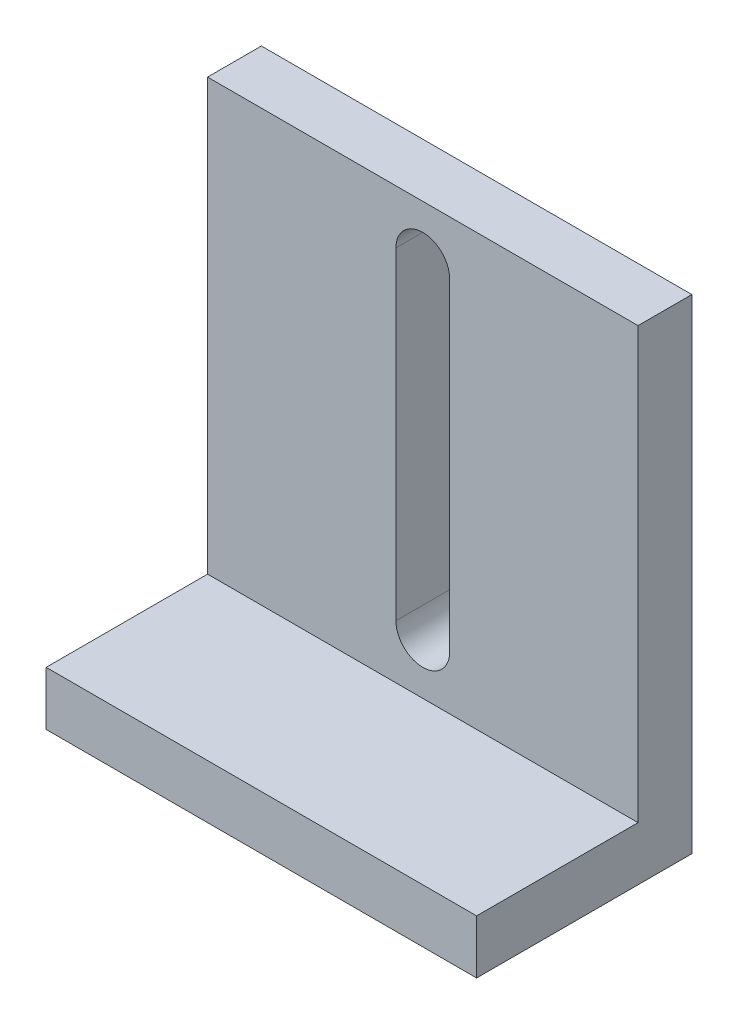
from build123d import *

# Parameters (mm, degrees)
SKETCH1_W           = 25.4
SKETCH1_H           = 12.7
BOSS_EXTRUDE1_DEPTH = 3.175
SKETCH2_W           = 25.4
SKETCH2_H           = 3.175
BOSS_EXTRUDE2_DEPTH = 25.4
CUT_EXTRUDE1_DEPTH  = 33.688625698


with BuildPart() as part:
    # Sketch1 → Boss-Extrude1 (new body)
    with BuildSketch(Plane(origin=(0, 0, 0), x_dir=(1, 0, 0), z_dir=(0, 1, 0))):
        Rectangle(SKETCH1_W, SKETCH1_H)
    extrude(amount=BOSS_EXTRUDE1_DEPTH)

    # Sketch2 → Boss-Extrude2 (add)
    with BuildSketch(Plane(origin=(0, 3.175, 0), x_dir=(1, 0, 0), z_dir=(0, 1, 0))):
        with Locations((0, 4.7625)):
            Rectangle(SKETCH2_W, SKETCH2_H)
    extrude(amount=BOSS_EXTRUDE2_DEPTH)

    # Sketch3 → Cut-Extrude1 (cut, through all)
    with BuildSketch(Plane.XY.offset(-3.175)):
        with BuildLine():
            Line((1.5875, 25.4), (1.5875, 6.35))
            ThreePointArc((1.5875, 6.35), (0, 4.7625), (-1.5875, 6.35))
            Line((-1.5875, 6.35), (-1.5875, 25.4))
            ThreePointArc((-1.5875, 25.4), (0, 26.9875), (1.5875, 25.4))
        make_face()
    extrude(amount=-CUT_EXTRUDE1_DEPTH, mode=Mode.SUBTRACT)


solid = part.part
